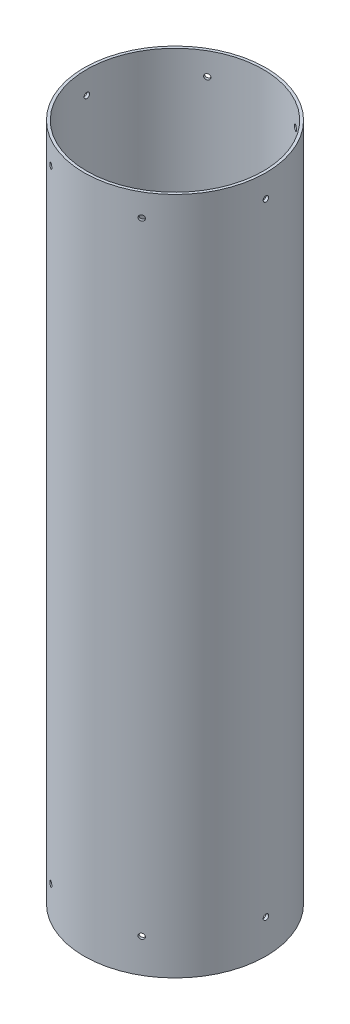
from build123d import *

# Parameters (mm, degrees)
SKETCH1_R           = 51.054
SKETCH1_R_2         = 49.53
BOSS_EXTRUDE1_DEPTH = 381
SKETCH2_R           = 1.524
CUT_EXTRUDE1_DEPTH  = 136.398
CIRPATTERN1_COUNT   = 6
SKETCH3_R           = 1.524
CUT_EXTRUDE2_DEPTH  = 177.8
CIRPATTERN2_COUNT   = 6


with BuildPart() as part:
    # Sketch1 → Boss-Extrude1 (new body)
    with BuildSketch(Plane(origin=(0, 0, 0), x_dir=(1, 0, 0), z_dir=(0, 1, 0))):
        with Locations(Location((0, 0, 0), (0, 0, 270))):
            Circle(SKETCH1_R)
        with Locations(Location((0, 0, 0), (0, 0, 270))):
            Circle(SKETCH1_R_2, mode=Mode.SUBTRACT)
    extrude(amount=BOSS_EXTRUDE1_DEPTH)

    # Sketch2 → Cut-Extrude1 (cut)
    with BuildSketch(Plane(origin=(0, 0, 0), x_dir=(0, 0, -1), z_dir=(1, 0, 0))):
        with Locations((0, 19.05)):
            Circle(SKETCH2_R)
    cut_extrude1 = extrude(amount=-CUT_EXTRUDE1_DEPTH, mode=Mode.SUBTRACT)

    # CirPattern1: Cut-Extrude1 ×6 about axis
    cirpattern1_axis = Axis((0, 381, 0), (0, -1, 0))
    for i in range(1, CIRPATTERN1_COUNT):
        add(cut_extrude1.rotate(cirpattern1_axis, i * 360 / CIRPATTERN1_COUNT), mode=Mode.SUBTRACT)

    # Sketch3 → Cut-Extrude2 (cut)
    with BuildSketch(Plane(origin=(0, 0, 0), x_dir=(0, 0, -1), z_dir=(1, 0, 0))):
        with Locations((0, 368.3)):
            Circle(SKETCH3_R)
    cut_extrude2 = extrude(amount=-CUT_EXTRUDE2_DEPTH, mode=Mode.SUBTRACT)

    # CirPattern2: Cut-Extrude2 ×6 about axis
    cirpattern2_axis = Axis((0, 381, 0), (0, -1, 0))
    for i in range(1, CIRPATTERN2_COUNT):
        add(cut_extrude2.rotate(cirpattern2_axis, i * 360 / CIRPATTERN2_COUNT), mode=Mode.SUBTRACT)


solid = part.part
